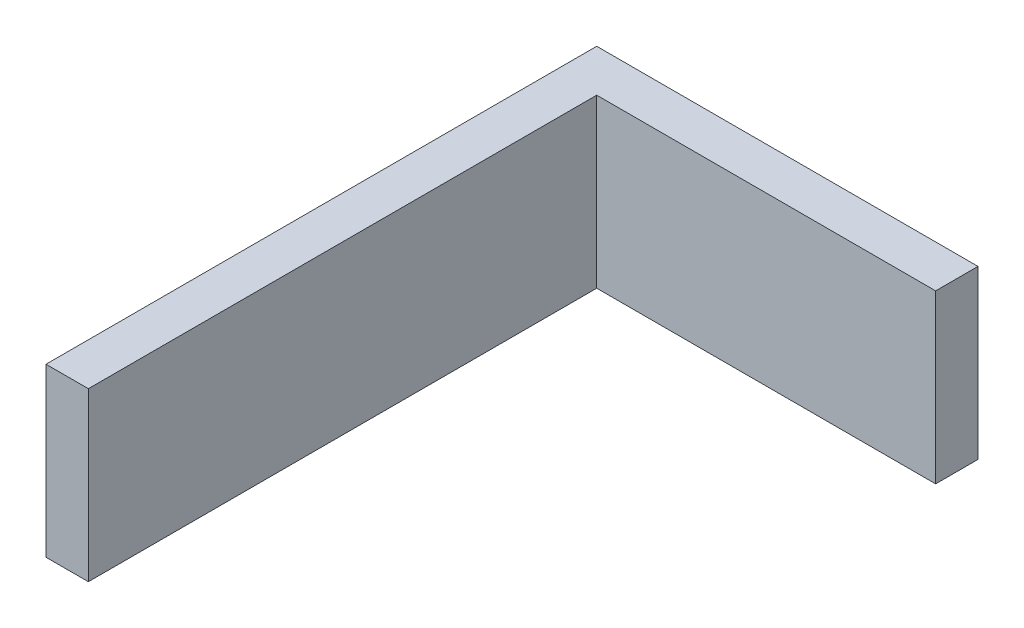
from build123d import *

# Parameters (mm, degrees)
BOSS_EXTRUDE1_DEPTH                            = 38.1
CBORE_FOR_4_SOCKET_HEAD_CAP_SCREW1_D           = 3.2639
CBORE_FOR_4_SOCKET_HEAD_CAP_SCREW1_DEPTH       = 12.7
CBORE_FOR_4_SOCKET_HEAD_CAP_SCREW1_CBORE_D     = 3.96875
CBORE_FOR_4_SOCKET_HEAD_CAP_SCREW1_CBORE_DEPTH = 4.7625
CBORE_FOR_4_SOCKET_HEAD_CAP_SCREW1_TIP         = 0.980574487
SKETCH4_W                                      = 5.092540148
SKETCH4_H                                      = 4.288454861
CUT_EXTRUDE1_DEPTH                             = 0.79375
CHAMFER1_SIZE                                  = 0.508


with BuildPart() as part:
    # Sketch1 → Boss-Extrude1 (new body)
    with BuildSketch(Plane(origin=(0, 0, 0), x_dir=(1, 0, 0), z_dir=(0, 1, 0))):
        Polygon((0, 0), (85.725, 0), (85.725, -9.525), (9.525, -9.525), (9.525, -123.825), (0, -123.825), align=None)
    extrude(amount=BOSS_EXTRUDE1_DEPTH)

    # CBORE for #4 Socket Head Cap Screw1
    with Locations(Plane(origin=(0, 0, 0), x_dir=(-1, 0, 0), z_dir=(0, -1, 0))):
        with Locations((-4.7625, -4.7625), (-4.7625, -39.6875), (-4.7625, -74.6125), (-39.6875, -4.7625), (-74.6125, -4.7625), (-4.7625, -109.5375)):
            CounterBoreHole(CBORE_FOR_4_SOCKET_HEAD_CAP_SCREW1_D / 2, CBORE_FOR_4_SOCKET_HEAD_CAP_SCREW1_CBORE_D / 2, CBORE_FOR_4_SOCKET_HEAD_CAP_SCREW1_CBORE_DEPTH, depth=CBORE_FOR_4_SOCKET_HEAD_CAP_SCREW1_DEPTH)
            with Locations((0, 0, -(CBORE_FOR_4_SOCKET_HEAD_CAP_SCREW1_DEPTH + CBORE_FOR_4_SOCKET_HEAD_CAP_SCREW1_TIP / 2))):  # 118° drill point
                Cone(0, CBORE_FOR_4_SOCKET_HEAD_CAP_SCREW1_D / 2, CBORE_FOR_4_SOCKET_HEAD_CAP_SCREW1_TIP, mode=Mode.SUBTRACT)

    # Sketch4 → Cut-Extrude1 (cut)
    # profile 1 of 14: a face of its own
    with BuildSketch(Plane.ZY):
        with BuildLine():
            add(Edge.make_bspline(
                [(26.237199272, 29.31336293), (26.246278483, 29.238745086), (26.264910133, 29.085620154), (26.277394259, 28.888390951), (26.286364511, 28.71594732), (26.289351528, 28.56581), (26.295034944, 28.396237774), (26.294184209, 28.276852737), (26.293736518, 28.214027577)],
                knots=[0, 0, 0, 0, 1.228000411, 2.52000689, 3.227952835, 4.049439613, 4.973537463, 6, 6, 6, 6], degree=3))
            Line((26.293736518, 28.214027577), (26.293736518, 23.150803039))
            Line((26.293736518, 23.150803039), (25.221622803, 23.150803039))
            Line((25.221622803, 23.150803039), (25.221622803, 30.655599046))
            Line((25.221622803, 30.655599046), (26.256045021, 30.655599046))
            Line((26.256045021, 30.655599046), (29.949811805, 25.770362136))
            Line((29.949811805, 25.770362136), (33.396489882, 30.655599046))
            Line((33.396489882, 30.655599046), (34.468603597, 30.655599046))
            Line((34.468603597, 30.655599046), (34.468603597, 23.150803039))
            Line((34.468603597, 23.150803039), (33.396489882, 23.150803039))
            Line((33.396489882, 23.150803039), (33.396489882, 28.214027577))
            add(Edge.make_bspline(
                [(33.396489882, 28.214027577), (33.397140156, 28.237062986), (33.398776028, 28.295012412), (33.40343151, 28.401090514), (33.408956694, 28.544252943), (33.420006477, 28.715158757), (33.42963201, 28.892456597), (33.438005913, 29.055089344), (33.444600945, 29.192583807), (33.447516454, 29.27566845), (33.448839185, 29.31336293)],
                knots=[0, 0, 0, 0, 0.5025012, 1.264125894, 2.315320307, 3.626478431, 4.99841976, 6.187164947, 7.177539063, 8, 8, 8, 8], degree=3))
            add(Edge.make_bspline(
                [(33.448839185, 29.31336293), (33.404831014, 29.223673214), (33.323812119, 29.058554746), (33.203367172, 28.836787647), (33.10168688, 28.654655462), (33.032043451, 28.551480864), (33.000729155, 28.505089699)],
                knots=[0, 0, 0, 0, 1.295888997, 2.385727321, 3.274162517, 4, 4, 4, 4], degree=3))
            Line((33.000729155, 28.505089699), (30.09429588, 24.329709331))
            Line((30.09429588, 24.329709331), (29.769730205, 24.329709331))
            Line((29.769730205, 24.329709331), (26.748128464, 28.389921233))
            add(Edge.make_bspline(
                [(26.748128464, 28.389921233), (26.74390081, 28.395476636), (26.731464536, 28.411818679), (26.720059129, 28.42890118), (26.712530938, 28.440176564)],
                knots=[0, 0, 0, 0, 0.679890819, 2, 2, 2, 2], degree=3))
            add(Edge.make_bspline(
                [(26.712530938, 28.440176564), (26.660616257, 28.513527075), (26.55930996, 28.656663243), (26.427651719, 28.87590094), (26.317973595, 29.093062404), (26.26376814, 29.240900106), (26.237199272, 29.31336293)],
                knots=[0, 0, 0, 0, 1.080229624, 2.107959819, 3.072614268, 4, 4, 4, 4], degree=3))
        make_face()
    # profile 2 of 14: a face of its own
    with BuildSketch(Plane.ZY):
        with BuildLine():
            add(Edge.make_bspline(
                [(37.818958958, 27.835018627), (37.8192584, 27.903474416), (37.819833868, 28.035032503), (37.838157094, 28.223627166), (37.861432011, 28.395427896), (37.897658826, 28.55012656), (37.941985511, 28.688482256), (38.000280733, 28.808954777), (38.063200482, 28.915986271), (38.143861369, 29.003575523), (38.236893298, 29.078987073), (38.346272914, 29.144748414), (38.476231126, 29.194423232), (38.62004559, 29.242488642), (38.782798219, 29.273605925), (38.961550326, 29.299492305), (39.158874777, 29.313707725), (39.296585697, 29.314856836), (39.368498312, 29.315456902)],
                knots=[0, 0, 0, 0, 1.297212498, 2.49297829, 3.589733663, 4.581673871, 5.5023721, 6.337065571, 7.115631558, 7.846508981, 8.580256353, 9.381439152, 10.253887025, 11.212332417, 12.253125696, 13.389179513, 14.636630076, 16, 16, 16, 16], degree=3))
            Line((39.368498312, 29.315456902), (43.77421561, 29.315456902))
            add(Edge.make_bspline(
                [(43.77421561, 29.315456902), (43.846128584, 29.314857726), (43.983840193, 29.313710319), (44.181159957, 29.299483297), (44.3599276, 29.273635371), (44.522629255, 29.242391925), (44.665997993, 29.19494407), (44.794825285, 29.14420251), (44.903707632, 29.079013396), (44.996888989, 29.003648161), (45.077152469, 28.915384446), (45.142850656, 28.809655063), (45.200551238, 28.688370738), (45.245108596, 28.550160234), (45.281265436, 28.395417526), (45.304561856, 28.223630331), (45.322878623, 28.035031603), (45.323455032, 27.903474108), (45.323754965, 27.835018627)],
                knots=[0, 0, 0, 0, 1.36381119, 2.611665499, 3.74808701, 4.78921715, 5.747972749, 6.608468092, 7.4099102, 8.143895055, 8.875009032, 9.660883388, 10.495847014, 11.416843235, 12.409104492, 13.506214838, 14.702367649, 16, 16, 16, 16], degree=3))
            Line((45.323754965, 27.835018627), (45.323754965, 24.610301593))
            add(Edge.make_bspline(
                [(45.323754965, 24.610301593), (45.323446602, 24.54254668), (45.322854227, 24.412387509), (45.304670369, 24.22583793), (45.280862689, 24.055598914), (45.245850109, 23.90183248), (45.199189426, 23.765592919), (45.146871879, 23.64389577), (45.077432421, 23.542974778), (45.001981047, 23.453365175), (44.907856446, 23.381666684), (44.800176835, 23.317818295), (44.67301944, 23.266045515), (44.527409596, 23.225045618), (44.36423048, 23.192219219), (44.183206241, 23.166914851), (43.984545854, 23.15256438), (43.846131838, 23.151405278), (43.77421561, 23.150803039)],
                knots=[0, 0, 0, 0, 1.291132478, 2.480303279, 3.570001314, 4.567466264, 5.480677238, 6.3144095, 7.082121688, 7.808221282, 8.537727528, 9.325140983, 10.190149002, 11.146183813, 12.205806884, 13.361366749, 14.629036607, 16, 16, 16, 16], degree=3))
            Line((43.77421561, 23.150803039), (39.368498312, 23.150803039))
            add(Edge.make_bspline(
                [(39.368498312, 23.150803039), (39.295870854, 23.151295878), (39.156733449, 23.152240043), (38.956945549, 23.167919678), (38.77477146, 23.189232138), (38.611179611, 23.223189961), (38.465372317, 23.263703834), (38.339089511, 23.316269069), (38.229915055, 23.377023055), (38.137609412, 23.449448946), (38.059420398, 23.536345106), (37.994911925, 23.640274116), (37.941244467, 23.761206958), (37.894258959, 23.897419832), (37.862615267, 24.051724877), (37.837658704, 24.22228493), (37.81995728, 24.410315166), (37.819300639, 24.541855199), (37.818958958, 24.610301593)],
                knots=[0, 0, 0, 0, 1.381189404, 2.646039317, 3.810440874, 4.867706802, 5.821614903, 6.684698702, 7.463712303, 8.191595755, 8.906156059, 9.676063403, 10.507941018, 11.419120545, 12.411439292, 13.498713282, 14.69846424, 16, 16, 16, 16], degree=3))
            Line((37.818958958, 24.610301593), (37.818958958, 27.835018627))
        make_face()
        with Locations((41.571356961, 26.233129971)):
            Rectangle(SKETCH4_W, SKETCH4_H, mode=Mode.SUBTRACT)
    # profile 3 of 14: a face of its own
    with BuildSketch(Plane.ZY):
        with BuildLine():
            Line((48.004039253, 23.150803039), (48.004039253, 29.315456902))
            Line((48.004039253, 29.315456902), (52.820175083, 29.315456902))
            add(Edge.make_bspline(
                [(52.820175083, 29.315456902), (52.87812561, 29.314676708), (52.989288928, 29.313180104), (53.150324141, 29.30114404), (53.298534687, 29.277861384), (53.434690877, 29.247478765), (53.557701949, 29.206707813), (53.66935435, 29.160416223), (53.766613542, 29.099857903), (53.882654351, 29.011209253), (54.002106622, 28.865727572), (54.099691005, 28.649158521), (54.161299069, 28.390477685), (54.166115354, 28.203253018), (54.168693116, 28.103047056)],
                knots=[0, 0, 0, 0, 0.992684566, 1.904212396, 2.763257824, 3.560861479, 4.290605036, 4.981401803, 5.625283573, 6.247140913, 7.477972399, 8.799107335, 10.286825486, 12, 12, 12, 12], degree=3))
            Line((54.168693116, 28.103047056), (54.168693116, 26.802690382))
            add(Edge.make_bspline(
                [(54.168693116, 26.802690382), (54.166132786, 26.70037495), (54.161343484, 26.508985723), (54.099341844, 26.24447237), (54.003536546, 26.021867588), (53.882056087, 25.874567643), (53.767370521, 25.782518497), (53.668752902, 25.722857851), (53.558297991, 25.673272961), (53.434589248, 25.633383667), (53.298578603, 25.602516644), (53.150197206, 25.580170265), (52.989417829, 25.564548575), (52.87814939, 25.563569189), (52.820175083, 25.563058898)],
                knots=[0, 0, 0, 0, 1.730837731, 3.237670892, 4.577316869, 5.804488502, 6.42724719, 7.064451801, 7.752880945, 8.475056941, 9.264389316, 10.114526302, 11.017609735, 12, 12, 12, 12], degree=3))
            Line((52.820175083, 25.563058898), (52.043311434, 25.563058898))
            Line((52.043311434, 25.563058898), (54.775945025, 23.150803039))
            Line((54.775945025, 23.150803039), (53.25572128, 23.150803039))
            Line((53.25572128, 23.150803039), (50.853935281, 25.563058898))
            Line((50.853935281, 25.563058898), (49.210167182, 25.563058898))
            Line((49.210167182, 25.563058898), (49.210167182, 23.150803039))
            Line((49.210167182, 23.150803039), (48.004039253, 23.150803039))
        make_face()
        with BuildLine():
            Line((52.334373556, 28.377357401), (49.210167182, 28.377357401))
            Line((49.210167182, 28.377357401), (49.210167182, 26.501158399))
            Line((49.210167182, 26.501158399), (52.334373556, 26.501158399))
            add(Edge.make_bspline(
                [(52.334373556, 26.501158399), (52.390939736, 26.502969635), (52.494755933, 26.506293805), (52.636553066, 26.524421103), (52.74856032, 26.561538979), (52.837005355, 26.615481117), (52.895559598, 26.699084327), (52.937794788, 26.804671833), (52.957957693, 26.939489985), (52.960936775, 27.037878112), (52.962565186, 27.091658531)],
                knots=[0, 0, 0, 0, 1.328572763, 2.438336303, 3.339802319, 4.084965982, 4.822163624, 5.689181353, 6.736872027, 8, 8, 8, 8], degree=3))
            Line((52.962565186, 27.091658531), (52.962565186, 27.786857269))
            add(Edge.make_bspline(
                [(52.962565186, 27.786857269), (52.961023674, 27.83646624), (52.958134518, 27.929445118), (52.935751967, 28.058215795), (52.889823689, 28.16208739), (52.830448067, 28.248039411), (52.741897195, 28.308673238), (52.629843575, 28.34935627), (52.491044526, 28.37371871), (52.389624635, 28.376074192), (52.334373556, 28.377357401)],
                knots=[0, 0, 0, 0, 1.180782498, 2.213064083, 3.083014709, 3.866770971, 4.663955562, 5.589046202, 6.686571281, 8, 8, 8, 8], degree=3))
        make_face(mode=Mode.SUBTRACT)
    # profile 4 of 14: a face of its own
    with BuildSketch(Plane.ZY):
        with BuildLine():
            Line((56.848977404, 23.150803039), (56.848977404, 29.315456902))
            Line((56.848977404, 29.315456902), (62.042028212, 29.315456902))
            add(Edge.make_bspline(
                [(62.042028212, 29.315456902), (62.100676215, 29.314654262), (62.213928487, 29.313104323), (62.377747305, 29.301241376), (62.528802224, 29.277978265), (62.667450601, 29.246862709), (62.793335872, 29.207978666), (62.905832597, 29.158641882), (63.007303677, 29.103631251), (63.123288271, 29.012275219), (63.244303093, 28.867787785), (63.349177955, 28.65141134), (63.404357771, 28.387706003), (63.411728139, 28.198211928), (63.41567391, 28.096765139)],
                knots=[0, 0, 0, 0, 0.991427834, 1.914497477, 2.773909551, 3.572527199, 4.315137857, 4.996851403, 5.646674228, 6.260354825, 7.482600806, 8.796575832, 10.285027676, 12, 12, 12, 12], degree=3))
            Line((63.41567391, 28.096765139), (63.41567391, 26.769186828))
            add(Edge.make_bspline(
                [(63.41567391, 26.769186828), (63.41171085, 26.669830695), (63.404290142, 26.483789416), (63.348911207, 26.224241558), (63.243700354, 26.010349117), (63.123311932, 25.866227709), (63.007298916, 25.774887139), (62.905833971, 25.719873171), (62.79333546, 25.670537358), (62.667450724, 25.631653024), (62.528802187, 25.600537555), (62.377747316, 25.577274418), (62.213928484, 25.565411479), (62.100676214, 25.563861539), (62.042028212, 25.563058898)],
                knots=[0, 0, 0, 0, 1.6893594, 3.163273082, 4.474189415, 5.703493501, 6.320717919, 6.974293277, 7.659943514, 8.406842526, 9.210071952, 10.074446874, 11.002846967, 12, 12, 12, 12], degree=3))
            Line((62.042028212, 25.563058898), (58.055105333, 25.563058898))
            Line((58.055105333, 25.563058898), (58.055105333, 23.150803039))
            Line((58.055105333, 23.150803039), (56.848977404, 23.150803039))
        make_face()
        with BuildLine():
            Line((61.522723131, 28.377357401), (58.055105333, 28.377357401))
            Line((58.055105333, 28.377357401), (58.055105333, 26.501158399))
            Line((58.055105333, 26.501158399), (61.522723131, 26.501158399))
            add(Edge.make_bspline(
                [(61.522723131, 26.501158399), (61.58211838, 26.502723437), (61.691662532, 26.505609876), (61.842212616, 26.526914901), (61.963979508, 26.565743745), (62.061135028, 26.621391035), (62.131993356, 26.701548281), (62.176370681, 26.804143806), (62.20713199, 26.925849448), (62.208702417, 27.014645605), (62.20954598, 27.062342922)],
                knots=[0, 0, 0, 0, 1.377634538, 2.540806027, 3.513527155, 4.32704192, 5.106833858, 5.9469763, 6.897207666, 8, 8, 8, 8], degree=3))
            Line((62.20954598, 27.062342922), (62.20954598, 27.816172878))
            add(Edge.make_bspline(
                [(62.20954598, 27.816172878), (62.208708512, 27.863878626), (62.207149431, 27.952690478), (62.176314811, 28.074294708), (62.132563839, 28.176298482), (62.06214427, 28.254691008), (61.968600737, 28.313895024), (61.845518648, 28.351494093), (61.693804995, 28.372950003), (61.582836034, 28.375808777), (61.522723131, 28.377357401)],
                knots=[0, 0, 0, 0, 1.102220973, 2.051960019, 2.89166718, 3.648212168, 4.456136745, 5.428353902, 6.60691574, 8, 8, 8, 8], degree=3))
        make_face(mode=Mode.SUBTRACT)
    # profile 5 of 14: a face of its own
    with BuildSketch(Plane.ZY):
        Polygon((65.55990134, 23.150803039), (65.55990134, 29.315456902), (66.76602927, 29.315456902), (66.76602927, 26.903201042), (71.590540989, 26.903201042), (71.590540989, 29.315456902), (72.796668919, 29.315456902), (72.796668919, 23.150803039), (71.590540989, 23.150803039), (71.590540989, 25.965101541), (66.76602927, 25.965101541), (66.76602927, 23.150803039), align=None)
    # profile 6 of 14: a face of its own
    with BuildSketch(Plane.ZY):
        Polygon((75.610967421, 23.150803039), (75.610967421, 29.315456902), (81.909635498, 29.315456902), (81.909635498, 28.377357401), (76.817095351, 28.377357401), (76.817095351, 26.903201042), (79.899422282, 26.903201042), (79.899422282, 25.965101541), (76.817095351, 25.965101541), (76.817095351, 24.08890254), (81.909635498, 24.08890254), (81.909635498, 23.150803039), align=None)
    # profile 7 of 14: a face of its own
    with BuildSketch(Plane.ZY):
        with BuildLine():
            Line((85.259990859, 29.315456902), (85.259990859, 24.08890254))
            Line((85.259990859, 24.08890254), (89.682459934, 24.08890254))
            Line((89.682459934, 24.08890254), (89.682459934, 29.315456902))
            Line((89.682459934, 29.315456902), (90.888587864, 29.315456902))
            Line((90.888587864, 29.315456902), (90.888587864, 24.614489537))
            add(Edge.make_bspline(
                [(90.888587864, 24.614489537), (90.888259317, 24.546041213), (90.887627916, 24.414497472), (90.869688496, 24.225804364), (90.845157482, 24.054483736), (90.813267532, 23.899516834), (90.76630717, 23.763300153), (90.712633561, 23.642368497), (90.64812739, 23.538438231), (90.569934912, 23.451545731), (90.477641333, 23.379106004), (90.368981301, 23.318722927), (90.243988682, 23.266238406), (90.100999553, 23.222451175), (89.939004231, 23.189454005), (89.759003479, 23.16784117), (89.561976635, 23.152309025), (89.424935588, 23.151318092), (89.353706314, 23.150803039)],
                knots=[0, 0, 0, 0, 1.307582334, 2.512907004, 3.61842977, 4.615358556, 5.53077117, 6.366513458, 7.139997579, 7.857877532, 8.589142529, 9.371775212, 10.226570304, 11.1759551, 12.225068416, 13.381646137, 14.639068742, 16, 16, 16, 16], degree=3))
            Line((89.353706314, 23.150803039), (85.601308311, 23.150803039))
            add(Edge.make_bspline(
                [(85.601308311, 23.150803039), (85.52939074, 23.15139944), (85.390974139, 23.152547307), (85.192331496, 23.166974905), (85.011925852, 23.191928974), (84.849598118, 23.225390798), (84.704515129, 23.265891597), (84.577133457, 23.318461501), (84.46790872, 23.380968634), (84.373845212, 23.453596918), (84.296951331, 23.542502673), (84.232389214, 23.647015382), (84.174900153, 23.766482197), (84.13277908, 23.904549945), (84.096441435, 24.057568562), (84.072902503, 24.228654987), (84.054825798, 24.415876176), (84.054191408, 24.546733364), (84.053862929, 24.614489537)],
                knots=[0, 0, 0, 0, 1.369502842, 2.635822193, 3.790150987, 4.835626121, 5.790642424, 6.654728909, 7.452790201, 8.18151927, 8.906845316, 9.677647099, 10.516095316, 11.424158824, 12.420561128, 13.509098257, 14.710243025, 16, 16, 16, 16], degree=3))
            Line((84.053862929, 24.614489537), (84.053862929, 29.315456902))
            Line((84.053862929, 29.315456902), (85.259990859, 29.315456902))
        make_face()
    # profile 8 of 14: a face of its own
    with BuildSketch(Plane.ZY):
        with BuildLine():
            Line((99.197469157, 28.377357401), (94.909014296, 28.377357401))
            Line((94.909014296, 28.377357401), (94.909014296, 26.769186828))
            Line((94.909014296, 26.769186828), (98.83102404, 26.769186828))
            add(Edge.make_bspline(
                [(98.83102404, 26.769186828), (98.897365601, 26.768633578), (99.025340858, 26.767566338), (99.208484437, 26.75253302), (99.375675592, 26.729843614), (99.526210479, 26.698821259), (99.661558763, 26.66018677), (99.779261093, 26.609493474), (99.882032439, 26.551538712), (99.967155531, 26.480282405), (100.042036497, 26.398488725), (100.101059713, 26.298334786), (100.153995186, 26.184121905), (100.197775343, 26.053616823), (100.230868262, 25.906258296), (100.252640653, 25.742261266), (100.268095847, 25.561956528), (100.269073218, 25.436061853), (100.269582873, 25.370413465)],
                knots=[0, 0, 0, 0, 1.340938794, 2.586719117, 3.712323982, 4.75020512, 5.69233428, 6.552125712, 7.336327403, 8.068114133, 8.787688697, 9.567050377, 10.406804399, 11.330575862, 12.343893456, 13.455522849, 14.673170064, 16, 16, 16, 16], degree=3))
            Line((100.269582873, 25.370413465), (100.269582873, 24.627053369))
            add(Edge.make_bspline(
                [(100.269582873, 24.627053369), (100.269042972, 24.557920984), (100.268005435, 24.425067941), (100.252908542, 24.234950245), (100.230254213, 24.062203852), (100.19967515, 23.906446951), (100.158753797, 23.76775781), (100.1058921, 23.647179284), (100.045266571, 23.543409555), (99.975226514, 23.454531286), (99.889557134, 23.380895433), (99.788465751, 23.318439845), (99.669967786, 23.266214405), (99.534724486, 23.225213628), (99.383448721, 23.192092891), (99.214936063, 23.166866047), (99.028807027, 23.15254626), (98.898754141, 23.151399999), (98.83102404, 23.150803039)],
                knots=[0, 0, 0, 0, 1.357635134, 2.608993698, 3.743340878, 4.778565969, 5.724106593, 6.577479946, 7.358146862, 8.079751231, 8.789138606, 9.565216875, 10.406052176, 11.325384268, 12.336634698, 13.445760771, 14.669780534, 16, 16, 16, 16], degree=3))
            Line((98.83102404, 23.150803039), (95.114223562, 23.150803039))
            add(Edge.make_bspline(
                [(95.114223562, 23.150803039), (95.042306191, 23.151399785), (94.903889975, 23.152548317), (94.705244691, 23.166971353), (94.524847797, 23.19194054), (94.362491731, 23.225353414), (94.217500723, 23.266013127), (94.090381047, 23.317839041), (93.982599852, 23.381618506), (93.888814853, 23.453525673), (93.811964127, 23.542520476), (93.747429428, 23.647020512), (93.689474061, 23.76703669), (93.647888971, 23.906704082), (93.611439081, 24.061765481), (93.587929506, 24.234947302), (93.569774788, 24.424951168), (93.569181004, 24.55790065), (93.568872152, 24.627053369)],
                knots=[0, 0, 0, 0, 1.36378352, 2.624814463, 3.774322544, 4.815431561, 5.766459521, 6.626937405, 7.410227097, 8.135912846, 8.858209783, 9.62579254, 10.460739226, 11.377616515, 12.382755254, 13.479843341, 14.689158583, 16, 16, 16, 16], degree=3))
            Line((93.568872152, 24.627053369), (93.568872152, 24.800853054))
            Line((93.568872152, 24.800853054), (94.640985867, 25.027002041))
            Line((94.640985867, 25.027002041), (94.640985867, 24.08890254))
            Line((94.640985867, 24.08890254), (99.197469157, 24.08890254))
            Line((99.197469157, 24.08890254), (99.197469157, 25.831087327))
            Line((99.197469157, 25.831087327), (95.344560493, 25.831087327))
            add(Edge.make_bspline(
                [(95.344560493, 25.831087327), (95.274030234, 25.831598878), (95.139081522, 25.832577652), (94.945509169, 25.847956212), (94.769920505, 25.870194278), (94.610774655, 25.9012437), (94.469597021, 25.941969843), (94.34610187, 25.992765642), (94.239576783, 26.051034715), (94.149078106, 26.121221892), (94.074043762, 26.206529217), (94.008210139, 26.305105007), (93.957039326, 26.422747534), (93.913220417, 26.555256998), (93.877635911, 26.704384003), (93.853264441, 26.870411599), (93.838561664, 27.052999412), (93.837469728, 27.180273581), (93.836900581, 27.246612467)],
                knots=[0, 0, 0, 0, 1.381938842, 2.644125647, 3.803046539, 4.84935624, 5.818988675, 6.67766686, 7.461608789, 8.192298858, 8.909155949, 9.67937091, 10.505844064, 11.414295287, 12.413020292, 13.50612753, 14.700123341, 16, 16, 16, 16], degree=3))
            Line((93.836900581, 27.246612467), (93.836900581, 27.835018627))
            add(Edge.make_bspline(
                [(93.836900581, 27.835018627), (93.837465267, 27.903452356), (93.83855, 28.034910071), (93.853365051, 28.223738027), (93.877341863, 28.395424635), (93.913726098, 28.549887204), (93.956520532, 28.687621585), (94.008857956, 28.810159624), (94.073369687, 28.914357943), (94.148847152, 29.004335035), (94.239923985, 29.078279847), (94.344631433, 29.144283362), (94.470040342, 29.195404398), (94.610162689, 29.242004826), (94.769936879, 29.273963241), (94.945309984, 29.299293386), (95.139111624, 29.313761708), (95.274040566, 29.31487503), (95.344560493, 29.315456902)],
                knots=[0, 0, 0, 0, 1.314259834, 2.524626339, 3.635794736, 4.64077054, 5.569415267, 6.403950249, 7.192747771, 7.91553845, 8.648578487, 9.437376009, 10.284207025, 11.242482078, 12.270712213, 13.408420669, 14.645524223, 16, 16, 16, 16], degree=3))
            Line((95.344560493, 29.315456902), (98.747265156, 29.315456902))
            add(Edge.make_bspline(
                [(98.747265156, 29.315456902), (98.816399017, 29.314915679), (98.94995104, 29.31387015), (99.141431006, 29.298609104), (99.316508318, 29.276626213), (99.474346293, 29.243703316), (99.615582007, 29.199134371), (99.741087308, 29.148053974), (99.85040957, 29.087265067), (99.941930331, 29.014161169), (100.022414811, 28.930686447), (100.088239483, 28.831284053), (100.145591591, 28.71903269), (100.191182505, 28.592298242), (100.226693647, 28.451289563), (100.250258964, 28.29627813), (100.268773174, 28.127215267), (100.269304949, 28.009575516), (100.269582873, 27.94809312)],
                knots=[0, 0, 0, 0, 1.381375786, 2.668526366, 3.836537679, 4.906364865, 5.885880787, 6.792659667, 7.611112155, 8.375845942, 9.125803975, 9.919018928, 10.748806554, 11.640326177, 12.604623837, 13.650442043, 14.772043885, 16, 16, 16, 16], degree=3))
            Line((100.269582873, 27.94809312), (100.269582873, 27.799421101))
            Line((100.269582873, 27.799421101), (99.197469157, 27.573272114))
            Line((99.197469157, 27.573272114), (99.197469157, 28.377357401))
        make_face()
    # profile 9 of 14: a face of its own
    with BuildSketch(Plane.ZY):
        with BuildLine():
            Line((42.375442248, 13.573893317), (37.014873671, 13.573893317))
            Line((37.014873671, 13.573893317), (37.014873671, 11.5636801))
            Line((37.014873671, 11.5636801), (41.787036087, 11.5636801))
            add(Edge.make_bspline(
                [(41.787036087, 11.5636801), (41.8694213, 11.562343526), (42.028088154, 11.559769398), (42.256182519, 11.543928459), (42.463853789, 11.514498877), (42.651842319, 11.475553865), (42.819949525, 11.424065804), (42.967411706, 11.359095794), (43.094705034, 11.283924632), (43.203403262, 11.195575723), (43.295522073, 11.090249463), (43.372617043, 10.9652679), (43.437635793, 10.820042159), (43.492166913, 10.655369883), (43.529448868, 10.4687468), (43.562711645, 10.26367339), (43.577458893, 10.036684492), (43.58016098, 9.878739439), (43.581570177, 9.796367648)],
                knots=[0, 0, 0, 0, 1.328543116, 2.558660091, 3.684011556, 4.708296874, 5.651654792, 6.513321266, 7.300863837, 8.028632613, 8.762382081, 9.546216273, 10.38734976, 11.323428157, 12.336709029, 13.452564641, 14.671456884, 16, 16, 16, 16], degree=3))
            Line((43.581570177, 9.796367648), (43.581570177, 8.944121003))
            add(Edge.make_bspline(
                [(43.581570177, 8.944121003), (43.580297067, 8.859634548), (43.577863885, 8.698163028), (43.561398094, 8.465984382), (43.533339672, 8.255110382), (43.491014249, 8.065580242), (43.440022273, 7.896503304), (43.374771911, 7.749153051), (43.29979349, 7.621214037), (43.209716277, 7.513033019), (43.101873838, 7.423658108), (42.975421837, 7.347328915), (42.828855613, 7.283330224), (42.660845717, 7.231301829), (42.472491452, 7.189762585), (42.262416474, 7.161174631), (42.031588613, 7.145014955), (41.870821366, 7.142514276), (41.787036087, 7.141211025)],
                knots=[0, 0, 0, 0, 1.346293302, 2.57305181, 3.707213295, 4.732700712, 5.664975709, 6.516519004, 7.294809232, 8.021131687, 8.747454142, 9.516227799, 10.367771094, 11.289435408, 12.314922825, 13.438067717, 14.664826225, 16, 16, 16, 16], degree=3))
            Line((41.787036087, 7.141211025), (37.366660984, 7.141211025))
            add(Edge.make_bspline(
                [(37.366660984, 7.141211025), (37.287760007, 7.142502557), (37.136749247, 7.144974456), (36.919846764, 7.161224141), (36.723014207, 7.189777852), (36.545464179, 7.231175813), (36.387839284, 7.285811168), (36.247772954, 7.350038044), (36.127656036, 7.427386744), (36.025353916, 7.518061692), (35.939666859, 7.625649563), (35.868937241, 7.753610904), (35.808130959, 7.901901581), (35.758992844, 8.070411842), (35.721550414, 8.259668939), (35.695171231, 8.468878703), (35.678397399, 8.699555641), (35.675987479, 8.860331326), (35.674731527, 8.944121003)],
                knots=[0, 0, 0, 0, 1.295366464, 2.479237682, 3.568301104, 4.557797364, 5.467429819, 6.303022328, 7.081754597, 7.804059379, 8.537817863, 9.328099936, 10.196370306, 11.164467711, 12.205002338, 13.360583175, 14.624444467, 16, 16, 16, 16], degree=3))
            Line((35.674731527, 8.944121003), (35.674731527, 9.149330269))
            Line((35.674731527, 9.149330269), (36.746845242, 9.41945267))
            Line((36.746845242, 9.41945267), (36.746845242, 8.21332474))
            Line((36.746845242, 8.21332474), (42.509456462, 8.21332474))
            Line((42.509456462, 8.21332474), (42.509456462, 10.491566385))
            Line((42.509456462, 10.491566385), (37.645159273, 10.491566385))
            add(Edge.make_bspline(
                [(37.645159273, 10.491566385), (37.565551984, 10.492813506), (37.41243513, 10.49521222), (37.192963572, 10.512166868), (36.993157531, 10.537749476), (36.814156518, 10.578272741), (36.653982354, 10.626727384), (36.514476603, 10.690391804), (36.393974179, 10.763014581), (36.291286216, 10.848700576), (36.208540045, 10.953175633), (36.137198524, 11.073783118), (36.076043097, 11.214376409), (36.026973036, 11.374591507), (35.989704843, 11.554850863), (35.963249111, 11.753592217), (35.946390751, 11.972417565), (35.944005657, 12.124831744), (35.942759956, 12.204435563)],
                knots=[0, 0, 0, 0, 1.336523522, 2.570672591, 3.694432872, 4.715202753, 5.649266837, 6.498934532, 7.282850333, 8.006164405, 8.730996054, 9.508843418, 10.353728782, 11.298975283, 12.317252768, 13.441013048, 14.663476478, 16, 16, 16, 16], degree=3))
            Line((35.942759956, 12.204435563), (35.942759956, 12.830533221))
            add(Edge.make_bspline(
                [(35.942759956, 12.830533221), (35.944003516, 12.915019496), (35.946380224, 13.076490673), (35.963224483, 13.308579369), (35.990025582, 13.519747731), (36.025915741, 13.710821956), (36.077211922, 13.880027518), (36.136134023, 14.029138713), (36.208619958, 14.156870575), (36.29104947, 14.267562259), (36.393041739, 14.359822362), (36.513757056, 14.437112868), (36.654342772, 14.501679358), (36.813239287, 14.556715998), (36.993690977, 14.593913839), (37.192473375, 14.627184724), (37.412516845, 14.641850799), (37.565579936, 14.644585321), (37.645159273, 14.646007032)],
                knots=[0, 0, 0, 0, 1.376570325, 2.630917618, 3.789078705, 4.844084945, 5.793995748, 6.666248003, 7.45058105, 8.18076719, 8.905262556, 9.678132743, 10.507435141, 11.420973463, 12.411545377, 13.505376956, 14.70301555, 16, 16, 16, 16], degree=3))
            Line((37.645159273, 14.646007032), (41.68024351, 14.646007032))
            add(Edge.make_bspline(
                [(41.68024351, 14.646007032), (41.760540794, 14.644699985), (41.915036472, 14.642185166), (42.137485383, 14.625947695), (42.34131481, 14.597377404), (42.525305588, 14.555463928), (42.690386607, 14.504675462), (42.834194759, 14.438108828), (42.961476208, 14.364481584), (43.068832343, 14.273647524), (43.160310418, 14.169073102), (43.238886268, 14.047907117), (43.30228486, 13.908252292), (43.358494479, 13.752650791), (43.394997391, 13.57755514), (43.42856253, 13.38726351), (43.443453075, 13.178359416), (43.446150527, 13.033658213), (43.447555963, 12.958265519)],
                knots=[0, 0, 0, 0, 1.342795848, 2.583601166, 3.727567146, 4.780942874, 5.737020864, 6.609341233, 7.426083684, 8.188290841, 8.949245691, 9.742461551, 10.593595189, 11.509125206, 12.503004008, 13.579536429, 14.738882166, 16, 16, 16, 16], degree=3))
            Line((43.447555963, 12.958265519), (43.447555963, 12.803311584))
            Line((43.447555963, 12.803311584), (42.375442248, 12.501779601))
            Line((42.375442248, 12.501779601), (42.375442248, 13.573893317))
        make_face()
    # profile 10 of 14: a face of its own
    with BuildSketch(Plane.ZY):
        Polygon((46.797911323, 7.141211025), (46.797911323, 13.305864888), (48.004039253, 13.305864888), (48.004039253, 10.663272097), (51.884169554, 13.305864888), (53.498622044, 13.305864888), (48.95889053, 10.330330533), (54.034678901, 7.141211025), (52.127070318, 7.141211025), (48.004039253, 9.903160225), (48.004039253, 7.141211025), align=None)
    # profile 11 of 14: a face of its own
    with BuildSketch(Plane.ZY):
        Polygon((54.436721544, 7.141211025), (57.956688645, 13.305864888), (59.007862639, 13.305864888), (62.611588623, 7.141211025), (61.363581252, 7.141211025), (60.572059798, 8.481353169), (56.365269849, 8.481353169), (55.586312227, 7.141211025), align=None)
        Polygon((56.848977404, 9.41945267), (60.079976354, 9.41945267), (58.461335921, 12.39079908), align=None, mode=Mode.SUBTRACT)
    # profile 12 of 14: a face of its own
    with BuildSketch(Plane.ZY):
        Polygon((67.570114557, 12.367765387), (67.570114557, 7.141211025), (66.363986627, 7.141211025), (66.363986627, 12.367765387), (63.41567391, 12.367765387), (63.41567391, 13.305864888), (70.518427274, 13.305864888), (70.518427274, 12.367765387), align=None)
    # profile 13 of 14: a face of its own
    with BuildSketch(Plane.ZY):
        Polygon((72.260612061, 7.141211025), (72.260612061, 13.305864888), (78.559280138, 13.305864888), (78.559280138, 12.367765387), (73.466739991, 12.367765387), (73.466739991, 10.893609028), (76.549066922, 10.893609028), (76.549066922, 9.955509528), (73.466739991, 9.955509528), (73.466739991, 8.079310526), (78.559280138, 8.079310526), (78.559280138, 7.141211025), align=None)
    # profile 14 of 14: a face of its own
    with BuildSketch(Plane.ZY):
        with BuildLine():
            Line((86.19809036, 12.367765387), (81.909635498, 12.367765387))
            Line((81.909635498, 12.367765387), (81.909635498, 10.759594814))
            Line((81.909635498, 10.759594814), (85.831645242, 10.759594814))
            add(Edge.make_bspline(
                [(85.831645242, 10.759594814), (85.897986804, 10.759041564), (86.02596206, 10.757974324), (86.209105639, 10.742941006), (86.376296794, 10.7202516), (86.526831681, 10.689229245), (86.662179965, 10.650594756), (86.779882295, 10.59990146), (86.882653641, 10.541946698), (86.967776733, 10.470690391), (87.042657699, 10.388896711), (87.101680916, 10.288742772), (87.154616388, 10.174529891), (87.198396545, 10.044024809), (87.231489465, 9.896666282), (87.253261855, 9.732669252), (87.26871705, 9.552364514), (87.26969442, 9.426469839), (87.270204075, 9.360821451)],
                knots=[0, 0, 0, 0, 1.340938794, 2.586719117, 3.712323982, 4.75020512, 5.69233428, 6.552125712, 7.336327403, 8.068114133, 8.787688697, 9.567050377, 10.406804399, 11.330575862, 12.343893456, 13.455522849, 14.673170064, 16, 16, 16, 16], degree=3))
            Line((87.270204075, 9.360821451), (87.270204075, 8.617461356))
            add(Edge.make_bspline(
                [(87.270204075, 8.617461356), (87.269664174, 8.54832897), (87.268626637, 8.415475927), (87.253529744, 8.225358231), (87.230875416, 8.052611839), (87.200296352, 7.896854937), (87.159374999, 7.758165796), (87.106513302, 7.637587271), (87.045887774, 7.533817541), (86.975847717, 7.444939272), (86.890178336, 7.371303419), (86.789086954, 7.308847831), (86.670588988, 7.256622392), (86.535345689, 7.215621614), (86.384069923, 7.182500877), (86.215557265, 7.157274033), (86.029428229, 7.142954246), (85.899375343, 7.141807985), (85.831645242, 7.141211025)],
                knots=[0, 0, 0, 0, 1.357635134, 2.608993698, 3.743340878, 4.778565969, 5.724106593, 6.577479946, 7.358146862, 8.079751231, 8.789138606, 9.565216875, 10.406052176, 11.325384268, 12.336634698, 13.445760771, 14.669780534, 16, 16, 16, 16], degree=3))
            Line((85.831645242, 7.141211025), (82.114844764, 7.141211025))
            add(Edge.make_bspline(
                [(82.114844764, 7.141211025), (82.042927393, 7.141807771), (81.904511177, 7.142956303), (81.705865894, 7.157379339), (81.525468999, 7.182348526), (81.363112933, 7.2157614), (81.218121926, 7.256421113), (81.091002249, 7.308247027), (80.983221054, 7.372026492), (80.889436055, 7.443933659), (80.81258533, 7.532928462), (80.74805063, 7.637428498), (80.690095263, 7.757444676), (80.648510174, 7.897112068), (80.612060283, 8.052173468), (80.588550708, 8.225355289), (80.57039599, 8.415359154), (80.569802207, 8.548308636), (80.569493354, 8.617461356)],
                knots=[0, 0, 0, 0, 1.36378352, 2.624814463, 3.774322544, 4.815431561, 5.766459521, 6.626937405, 7.410227097, 8.135912846, 8.858209783, 9.62579254, 10.460739226, 11.377616515, 12.382755254, 13.479843341, 14.689158583, 16, 16, 16, 16], degree=3))
            Line((80.569493354, 8.617461356), (80.569493354, 8.79126104))
            Line((80.569493354, 8.79126104), (81.64160707, 9.017410027))
            Line((81.64160707, 9.017410027), (81.64160707, 8.079310526))
            Line((81.64160707, 8.079310526), (86.19809036, 8.079310526))
            Line((86.19809036, 8.079310526), (86.19809036, 9.821495313))
            Line((86.19809036, 9.821495313), (82.345181695, 9.821495313))
            add(Edge.make_bspline(
                [(82.345181695, 9.821495313), (82.274651436, 9.822006864), (82.139702725, 9.822985638), (81.946130371, 9.838364199), (81.770541707, 9.860602264), (81.611395857, 9.891651686), (81.470218223, 9.932377829), (81.346723072, 9.983173629), (81.240197986, 10.041442701), (81.149699308, 10.111629879), (81.074664964, 10.196937203), (81.008831341, 10.295512993), (80.957660528, 10.41315552), (80.913841619, 10.545664984), (80.878257114, 10.694791989), (80.853885644, 10.860819586), (80.839182866, 11.043407398), (80.838090931, 11.170681567), (80.837521783, 11.237020453)],
                knots=[0, 0, 0, 0, 1.381938842, 2.644125647, 3.803046539, 4.84935624, 5.818988675, 6.67766686, 7.461608789, 8.192298858, 8.909155949, 9.67937091, 10.505844064, 11.414295287, 12.413020292, 13.50612753, 14.700123341, 16, 16, 16, 16], degree=3))
            Line((80.837521783, 11.237020453), (80.837521783, 11.825426613))
            add(Edge.make_bspline(
                [(80.837521783, 11.825426613), (80.838086469, 11.893860342), (80.839171202, 12.025318057), (80.853986254, 12.214146013), (80.877963065, 12.385832621), (80.9143473, 12.54029519), (80.957141734, 12.678029571), (81.009479159, 12.80056761), (81.073990889, 12.904765929), (81.149468354, 12.994743021), (81.240545187, 13.068687833), (81.345252635, 13.134691348), (81.470661544, 13.185812384), (81.610783892, 13.232412812), (81.770558082, 13.264371227), (81.945931186, 13.289701373), (82.139732826, 13.304169694), (82.274661769, 13.305283016), (82.345181695, 13.305864888)],
                knots=[0, 0, 0, 0, 1.314259834, 2.524626339, 3.635794736, 4.64077054, 5.569415267, 6.403950249, 7.192747771, 7.91553845, 8.648578487, 9.437376009, 10.284207025, 11.242482078, 12.270712213, 13.408420669, 14.645524223, 16, 16, 16, 16], degree=3))
            Line((82.345181695, 13.305864888), (85.747886358, 13.305864888))
            add(Edge.make_bspline(
                [(85.747886358, 13.305864888), (85.817020219, 13.305323665), (85.950572242, 13.304278136), (86.142052209, 13.28901709), (86.31712952, 13.267034199), (86.474967495, 13.234111302), (86.616203209, 13.189542357), (86.74170851, 13.13846196), (86.851030772, 13.077673053), (86.942551533, 13.004569155), (87.023036014, 12.921094433), (87.088860685, 12.821692039), (87.146212794, 12.709440676), (87.191803707, 12.582706228), (87.227314849, 12.441697549), (87.250880166, 12.286686116), (87.269394376, 12.117623254), (87.269926151, 11.999983502), (87.270204075, 11.938501106)],
                knots=[0, 0, 0, 0, 1.381375786, 2.668526366, 3.836537679, 4.906364865, 5.885880787, 6.792659667, 7.611112155, 8.375845942, 9.125803975, 9.919018928, 10.748806554, 11.640326177, 12.604623837, 13.650442043, 14.772043885, 16, 16, 16, 16], degree=3))
            Line((87.270204075, 11.938501106), (87.270204075, 11.789829087))
            Line((87.270204075, 11.789829087), (86.19809036, 11.5636801))
            Line((86.19809036, 11.5636801), (86.19809036, 12.367765387))
        make_face()
    extrude(amount=-CUT_EXTRUDE1_DEPTH, mode=Mode.SUBTRACT)

    # Chamfer1
    chamfer1_edges = [part.edges().sort_by_distance(p)[0] for p in [
        (42.8625, 0, 0),
        (85.725, 0, 4.7625),
        (47.625, 0, 9.525),
        (9.525, 0, 66.675),
        (4.7625, 0, 123.825),
        (0, 0, 61.9125),
    ]]
    chamfer(chamfer1_edges, length=CHAMFER1_SIZE)


solid = part.part
